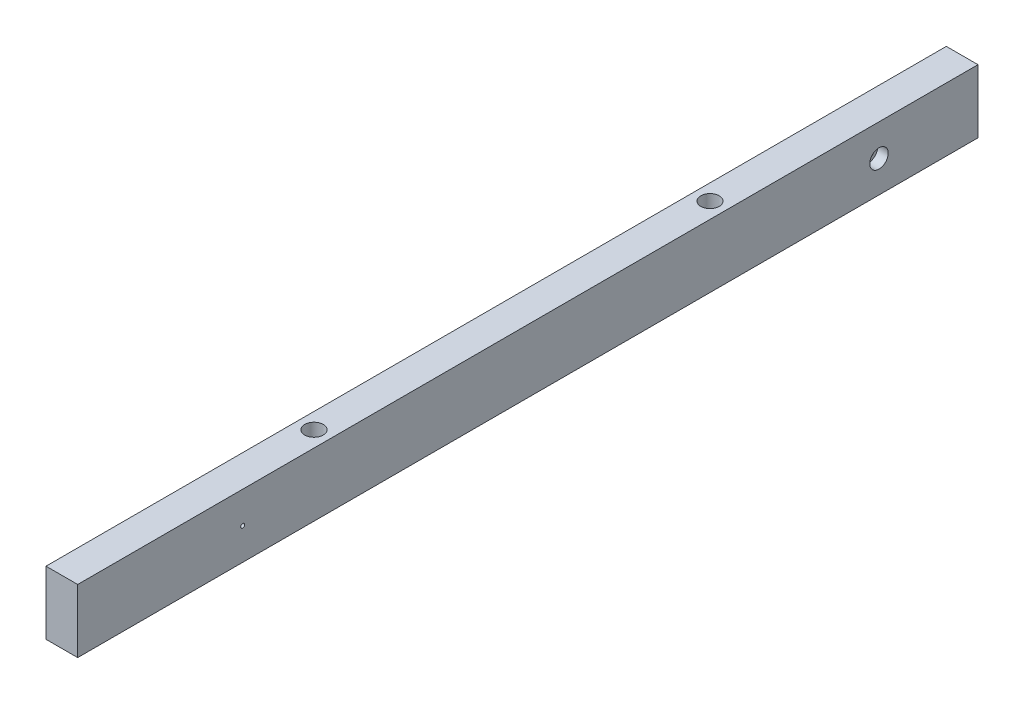
from build123d import *

# Parameters (mm, degrees)
ESQUISSE1_W             = 682
ESQUISSE1_H             = 48
BOSS_EXTRU_1_DEPTH      = 24
ESQUISSE2_R             = 4.5
ENL_V_MAT_EXTRU_1_DEPTH = 346.197045179
ESQUISSE3_R             = 10
ENL_V_MAT_EXTRU_2_DEPTH = 10
ESQUISSE4_R             = 7
ENL_V_MAT_EXTRU_3_DEPTH = 10
ESQUISSE5_R             = 1.5
ENL_V_MAT_EXTRU_4_DEPTH = 343.68498654
ESQUISSE6_R             = 4.5
ENL_V_MAT_EXTRU_5_DEPTH = 343.68498654
ESQUISSE7_R             = 7
ENL_V_MAT_EXTRU_6_DEPTH = 8


with BuildPart() as part:
    # Esquisse1 → Boss.-Extru.1 (new body)
    with BuildSketch(Plane(origin=(0, 0, 0), x_dir=(0, 0, -1), z_dir=(1, 0, 0))):
        Rectangle(ESQUISSE1_W, ESQUISSE1_H)
    extrude(amount=BOSS_EXTRU_1_DEPTH)

    # Esquisse2 → Enlèv. mat.-Extru.1 (cut, through all)
    with BuildSketch(Plane.XZ.offset(24)):
        with Locations(Location((12, 150, 0), (0, 0, 270))):
            Circle(ESQUISSE2_R)
        with Locations(Location((12, -150, 0), (0, 0, 270))):
            Circle(ESQUISSE2_R)
    extrude(amount=-ENL_V_MAT_EXTRU_1_DEPTH, mode=Mode.SUBTRACT)

    # Esquisse3 → Enlèv. mat.-Extru.2 (cut)
    with BuildSketch(Plane.XZ.offset(24)):
        with Locations(Location((12, 150, 0), (0, 0, 270))):
            Circle(ESQUISSE3_R)
        with Locations(Location((12, -150, 0), (0, 0, 270))):
            Circle(ESQUISSE3_R)
    extrude(amount=-ENL_V_MAT_EXTRU_2_DEPTH, mode=Mode.SUBTRACT)

    # Esquisse4 → Enlèv. mat.-Extru.3 (cut)
    with BuildSketch(Plane(origin=(0, 24, 0), x_dir=(-1, 0, 0), z_dir=(0, 1, 0))):
        with Locations(Location((-12, 150, 0), (0, 0, 90))):
            Circle(ESQUISSE4_R)
        with Locations(Location((-12, -150, 0), (0, 0, 90))):
            Circle(ESQUISSE4_R)
    extrude(amount=-ENL_V_MAT_EXTRU_3_DEPTH, mode=Mode.SUBTRACT)

    # Esquisse5 → Enlèv. mat.-Extru.4 (cut, through all)
    with BuildSketch(Plane(origin=(24, 0, 0), x_dir=(0, 0, -1), z_dir=(1, 0, 0))):
        with Locations((-216, 0)):
            Circle(ESQUISSE5_R)
    extrude(amount=-ENL_V_MAT_EXTRU_4_DEPTH, mode=Mode.SUBTRACT)

    # Esquisse6 → Enlèv. mat.-Extru.5 (cut, through all)
    with BuildSketch(Plane.ZY):
        with Locations((-266, 0)):
            Circle(ESQUISSE6_R)
    extrude(amount=-ENL_V_MAT_EXTRU_5_DEPTH, mode=Mode.SUBTRACT)

    # Esquisse7 → Enlèv. mat.-Extru.6 (cut)
    with BuildSketch(Plane.ZY.offset(-24)):
        with Locations((-266, 0)):
            Circle(ESQUISSE7_R)
    extrude(amount=ENL_V_MAT_EXTRU_6_DEPTH, mode=Mode.SUBTRACT)


solid = part.part
